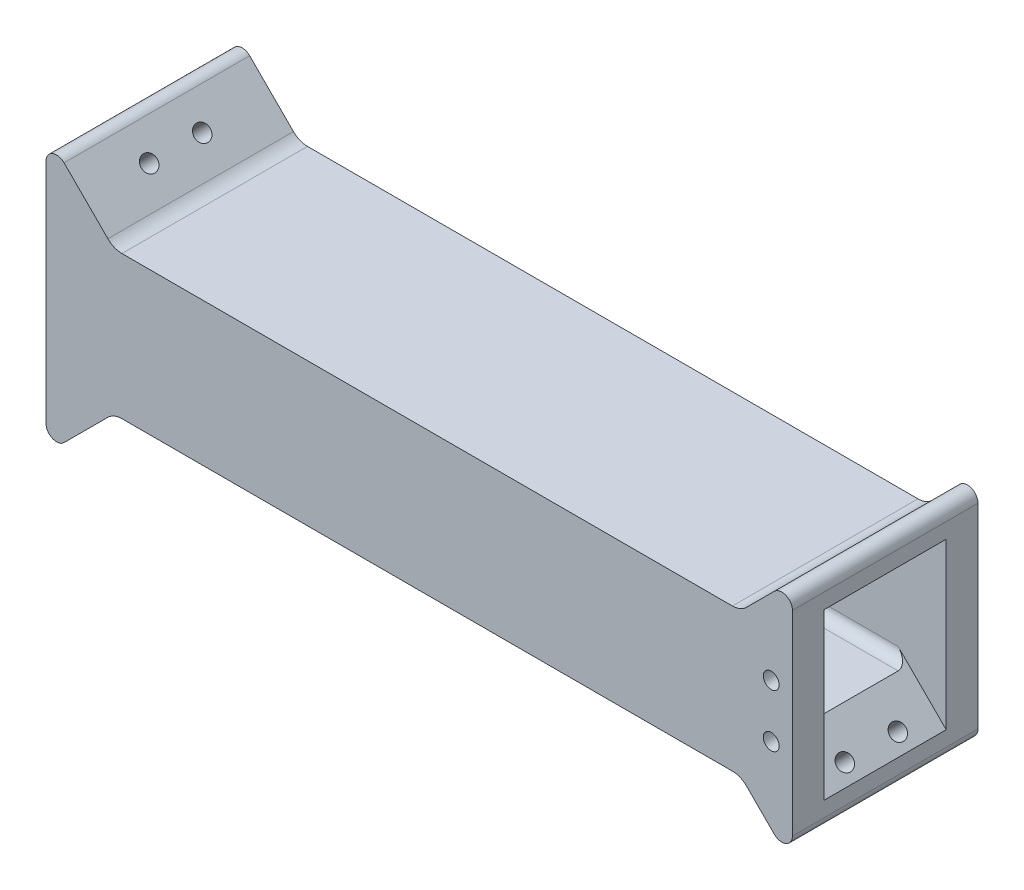
from build123d import *

# Parameters (mm, degrees)
EXTRUDE_1_DEPTH          = 35
CUT_EXTRUDE_1_DEPTH      = 185.022712326
SKETCH_3_W               = 23
SKETCH_3_H               = 16.98
CUT_EXTRUDE_2_DEPTH      = 159.069540958
SKETCH_5_W               = 23
SKETCH_5_H               = 7.5
CUT_EXTRUDE_3_DEPTH      = 5
SKETCH_6_R               = 1.5
CUT_EXTRUDE_4_DEPTH      = 138.067283793
MIRROR_2_COPY_1_SKETCH_W = 23
MIRROR_2_COPY_1_SKETCH_H = 7.5
MIRROR_2_COPY_1_DEPTH    = 5
MIRROR_2_COPY_2_SKETCH_R = 1.5
MIRROR_2_COPY_2_DEPTH    = 138.067283793
FILLET_3_R               = 2
SKETCH_7_R               = 1.5
CUT_EXTRUDE_5_DEPTH      = 8


with BuildPart() as part:
    # 草图1 → 凸台-拉伸1 (new body)
    with BuildSketch(Plane.XY):
        with BuildLine():
            ThreePointArc((40.282032616, -21.905575199), (41.494272902, -22.715568261), (42.924207815, -23))
            Line((42.924207815, -23), (158.071347708, -23))
            ThreePointArc((158.071347708, -23), (159.501282621, -22.715568261), (160.713522906, -21.905575199))
            Line((160.713522906, -21.905575199), (169.40335296, -13.215745145))
            Line((169.40335296, -13.215745145), (169.40335296, -59.784254855))
            Line((169.40335296, -59.784254855), (160.713522906, -51.094424801))
            ThreePointArc((160.713522906, -51.094424801), (159.501282621, -50.284431739), (158.071347708, -50))
            Line((158.071347708, -50), (42.924207815, -50))
            ThreePointArc((42.924207815, -50), (41.494272902, -50.284431739), (40.282032616, -51.094424801))
            Line((40.282032616, -51.094424801), (28.592202563, -62.784254855))
            Line((28.592202563, -62.784254855), (28.592202563, -10.215745145))
            Line((28.592202563, -10.215745145), (40.282032616, -21.905575199))
        make_face()
    extrude(amount=-EXTRUDE_1_DEPTH)

    # 草图2 → 切除-拉伸1 (cut, through all)
    with BuildSketch(Plane.XY):
        with BuildLine():
            Line((40.282032616, -21.905575199), (28.592202563, -10.215745145))
            Line((28.592202563, -10.215745145), (28.592202563, -62.784254855))
            Line((28.592202563, -62.784254855), (40.282032616, -51.094424801))
            ThreePointArc((40.282032616, -51.094424801), (41.494272902, -50.284431739), (42.924207815, -50))
            Line((42.924207815, -50), (158.071347708, -50))
            ThreePointArc((158.071347708, -50), (159.501282621, -50.284431739), (160.713522906, -51.094424801))
            Line((160.713522906, -51.094424801), (169.40335296, -59.784254855))
            Line((169.40335296, -59.784254855), (169.40335296, -13.215745145))
            Line((169.40335296, -13.215745145), (160.713522906, -21.905575199))
            ThreePointArc((160.713522906, -21.905575199), (159.501282621, -22.715568261), (158.071347708, -23))
            Line((158.071347708, -23), (42.924207815, -23))
            ThreePointArc((42.924207815, -23), (41.494272902, -22.715568261), (40.282032616, -21.905575199))
        make_face()
        with BuildLine():
            Line((28.602202563, -10.239887281), (28.602202563, -62.760112719))
            Line((28.602202563, -62.760112719), (40.274961549, -51.087353734))
            ThreePointArc((40.274961549, -51.087353734), (41.490446067, -50.275192944), (42.924207815, -49.99))
            Line((42.924207815, -49.99), (158.071347708, -49.99))
            ThreePointArc((158.071347708, -49.99), (159.505109455, -50.275192944), (160.720593974, -51.087353734))
            Line((160.720593974, -51.087353734), (169.39335296, -59.760112719))
            Line((169.39335296, -59.760112719), (169.39335296, -13.239887281))
            Line((169.39335296, -13.239887281), (160.720593974, -21.912646266))
            ThreePointArc((160.720593974, -21.912646266), (159.505109455, -22.724807057), (158.071347708, -23.01))
            Line((158.071347708, -23.01), (42.924207815, -23.01))
            ThreePointArc((42.924207815, -23.01), (41.490446067, -22.724807057), (40.274961549, -21.912646266))
            Line((40.274961549, -21.912646266), (28.602202563, -10.239887281))
        make_face(mode=Mode.SUBTRACT)
    extrude(amount=-CUT_EXTRUDE_1_DEPTH, mode=Mode.SUBTRACT)

    # 草图3 → 切除-拉伸2 (cut, through all)
    with BuildSketch(Plane(origin=(169.39335296, 0, 0), x_dir=(0, 0, -1), z_dir=(1, 0, 0))):
        with Locations((17.5, -36.5)):
            Rectangle(SKETCH_3_W, SKETCH_3_H)
    extrude(amount=-CUT_EXTRUDE_2_DEPTH, mode=Mode.SUBTRACT)

    # 草图5 → 切除-拉伸3 (cut)
    with BuildSketch(Plane(origin=(36.796101281, -36.796101281, 0), x_dir=(0, 0, -1), z_dir=(0.7071067811865873, -0.7071067811865078, 0))):
        with Locations((17.5, -15.337922697)):
            Rectangle(SKETCH_5_W, SKETCH_5_H)
        with Locations((17.5, -7.837922697)):
            Rectangle(SKETCH_5_W, SKETCH_5_H)
    cut_extrude_3 = extrude(amount=CUT_EXTRUDE_3_DEPTH, mode=Mode.SUBTRACT)

    # 草图6 → 切除-拉伸4 (cut, through all)
    with BuildSketch(Plane(origin=(40.331635187, -40.331635187, 0), x_dir=(0, 0, 1), z_dir=(-0.7071067811865871, 0.707106781186508, 0))):
        with Locations(Location((-12, -13.587922697, 0), (0, 0, 270))):
            Circle(SKETCH_6_R)
        with Locations(Location((-22, -13.587922697, 0), (0, 0, 270))):
            Circle(SKETCH_6_R)
    cut_extrude_4 = extrude(amount=-CUT_EXTRUDE_4_DEPTH, mode=Mode.SUBTRACT)

    # 镜向1: 切除-拉伸3, 切除-拉伸4 across plane
    add(cut_extrude_3.mirror(Plane.ZX.offset(-36.5)), mode=Mode.SUBTRACT)
    add(cut_extrude_4.mirror(Plane.ZX.offset(-36.5)), mode=Mode.SUBTRACT)

    # 镜向2: 切除-拉伸3, 切除-拉伸4 across plane
    add(cut_extrude_3.mirror(Plane(origin=(98.997777761, 0, 0), x_dir=(0, 0, 1), z_dir=(1, 0, 0))), mode=Mode.SUBTRACT)
    add(cut_extrude_4.mirror(Plane(origin=(98.997777761, 0, 0), x_dir=(0, 0, 1), z_dir=(1, 0, 0))), mode=Mode.SUBTRACT)

    # 镜向2 copy 1 sketch → 镜向2 copy 1 (cut)
    with BuildSketch(Plane(origin=(161.199454241, -36.203898719, 0), x_dir=(0, 0, -1), z_dir=(-0.7071067811865942, 0.7071067811865009, 0))):
        with Locations((17.5, -15.337922697)):
            Rectangle(MIRROR_2_COPY_1_SKETCH_W, MIRROR_2_COPY_1_SKETCH_H)
        with Locations((17.5, -7.837922697)):
            Rectangle(MIRROR_2_COPY_1_SKETCH_W, MIRROR_2_COPY_1_SKETCH_H)
    extrude(amount=MIRROR_2_COPY_1_DEPTH, mode=Mode.SUBTRACT)

    # 镜向2 copy 2 sketch → 镜向2 copy 2 (cut, through all)
    with BuildSketch(Plane(origin=(157.663920335, -32.668364813, 0), x_dir=(0, 0, 1), z_dir=(0.707106781186594, -0.7071067811865012, 0))):
        with Locations(Location((-12, -13.587922697, 0), (0, 0, 270))):
            Circle(MIRROR_2_COPY_2_SKETCH_R)
        with Locations(Location((-22, -13.587922697, 0), (0, 0, 270))):
            Circle(MIRROR_2_COPY_2_SKETCH_R)
    extrude(amount=-MIRROR_2_COPY_2_DEPTH, mode=Mode.SUBTRACT)

    # 圆角3
    fillet_3_edges = [part.edges().sort_by_distance(p)[0] for p in [
        (98.997777761, -44.99, -6),
        (98.997777761, -44.99, -29),
        (98.997777761, -28.01, -6),
        (98.997777761, -28.01, -29),
        (169.39335296, -13.239887281, -17.5),
        (169.39335296, -59.760112719, -17.5),
        (28.602202563, -62.760112719, -17.5),
        (28.602202563, -10.239887281, -17.5),
    ]]
    fillet(fillet_3_edges, radius=FILLET_3_R)

    # 草图7 → 切除-拉伸5 (cut)
    with BuildSketch(Plane.XY):
        with Locations((165.39335296, -41.5)):
            Circle(SKETCH_7_R)
        with Locations((165.39335296, -31.5)):
            Circle(SKETCH_7_R)
    extrude(amount=-CUT_EXTRUDE_5_DEPTH, mode=Mode.SUBTRACT)


solid = part.part
